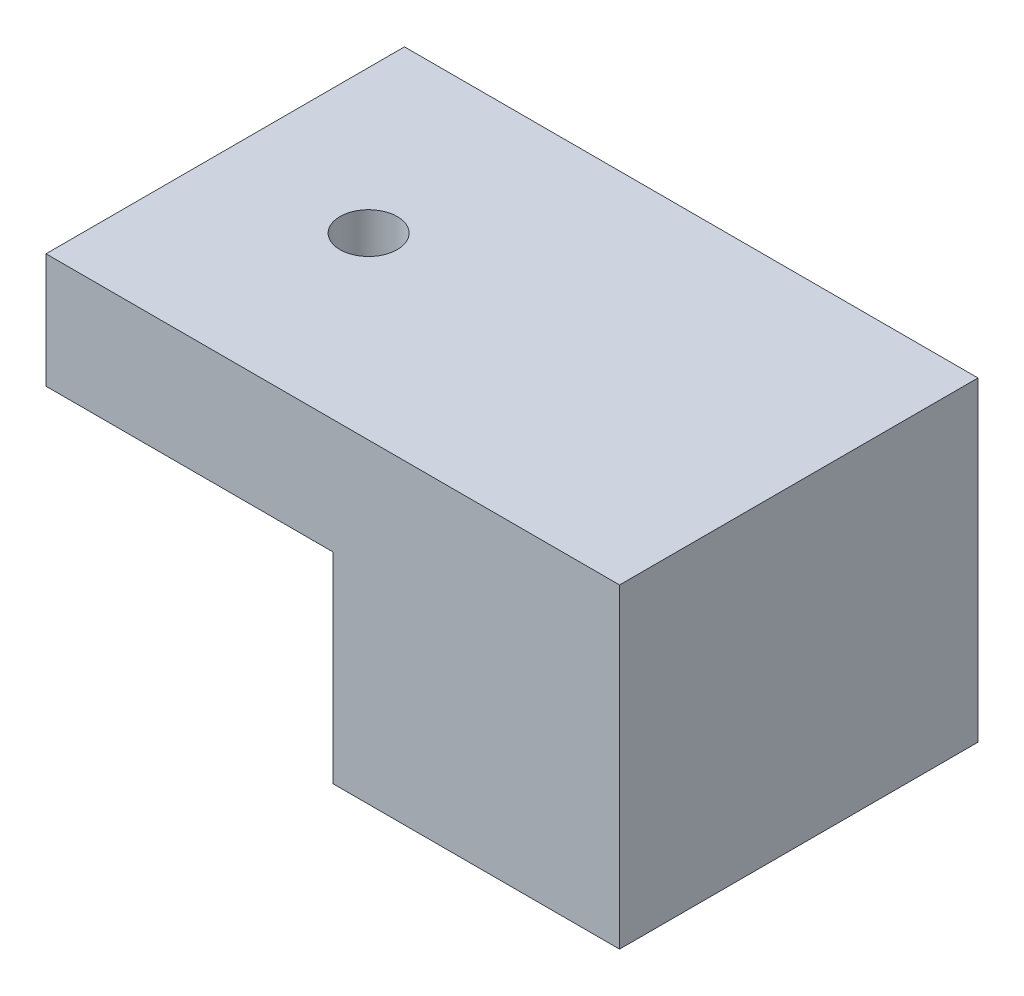
from build123d import *

# Parameters (mm, degrees)
BOSS_EXTRU_1_DEPTH           = 25
ENL_V_MAT_EXTRU_1_DEPTH      = 50.203658401
ENL_V_MAT_EXTRU_1_DEPTH_BACK = 50.203658401
ESQUISSE2_R                  = 2


with BuildPart() as part:
    # Esquisse1 → Boss.-Extru.1 (new body)
    with BuildSketch(Plane.XY):
        Polygon((0, 0), (20, 0), (20, -14), (40, -14), (40, 8), (0, 8), align=None)
    extrude(amount=BOSS_EXTRU_1_DEPTH)

    # Esquisse2 → Enlèv. mat.-Extru.1 (cut, two sides: drawn at the far end of the back side and taken through both)
    with BuildSketch(Plane.XZ.offset(-ENL_V_MAT_EXTRU_1_DEPTH_BACK)):
        with Locations(Location((10, 12.5, 0), (0, 0, 270))):
            Circle(ESQUISSE2_R)
    extrude(amount=ENL_V_MAT_EXTRU_1_DEPTH + ENL_V_MAT_EXTRU_1_DEPTH_BACK, mode=Mode.SUBTRACT)


solid = part.part
